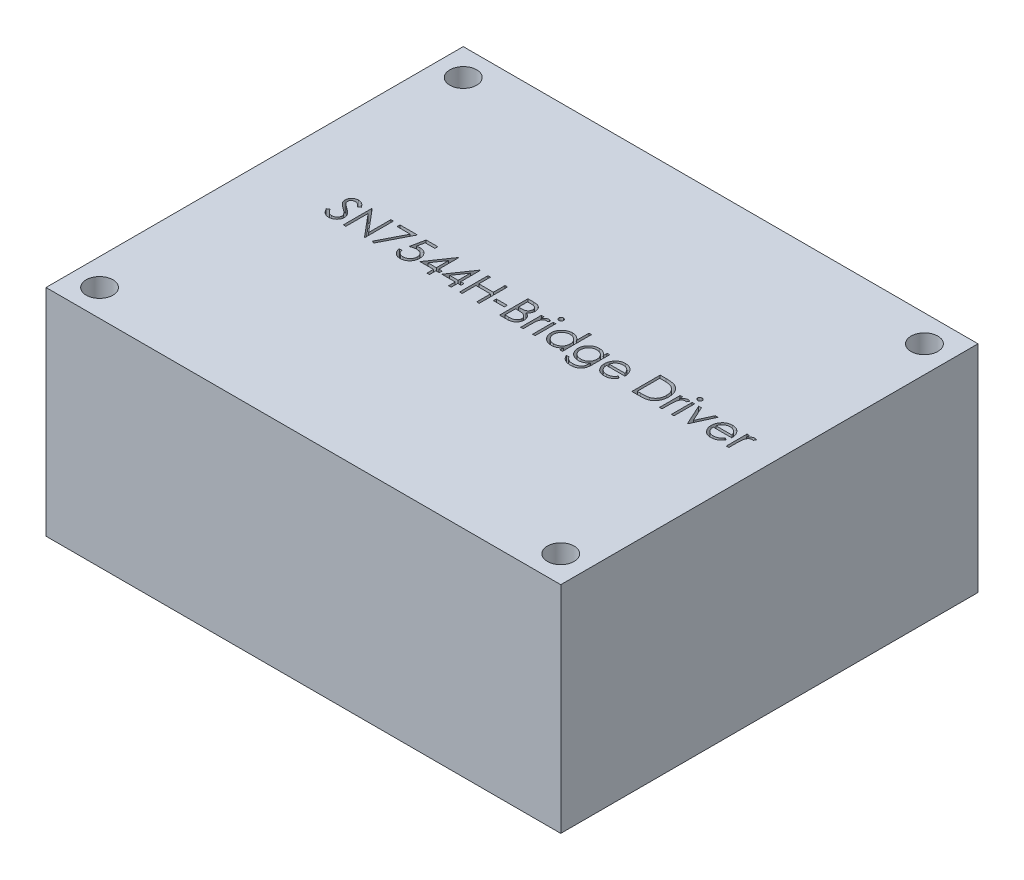
from build123d import *

# Parameters (mm, degrees)
SKETCH1_W           = 57.658
SKETCH1_H           = 46.736
BOSS_EXTRUDE1_DEPTH = 24.13
SKETCH2_R           = 1.5
CUT_EXTRUDE1_DEPTH  = 79.044574187
SKETCH3_W           = 1.221153846
SKETCH3_H           = 0.325641026
SKETCH3_W_2         = 0.284935897
SKETCH3_H_2         = 2.320192307
CUT_EXTRUDE2_DEPTH  = 1.27


with BuildPart() as part:
    # Sketch1 → Boss-Extrude1 (new body)
    with BuildSketch(Plane(origin=(0, 0, 0), x_dir=(1, 0, 0), z_dir=(0, 1, 0))):
        with Locations((28.829, 23.368)):
            Rectangle(SKETCH1_W, SKETCH1_H)
    extrude(amount=BOSS_EXTRUDE1_DEPTH)

    # Sketch2 → Cut-Extrude1 (cut, through all)
    with BuildSketch(Plane(origin=(0, 24.13, 0), x_dir=(1, 0, 0), z_dir=(0, 1, 0))):
        with Locations(Location((3, 43.736, 0), (0, 0, 270))):
            Circle(SKETCH2_R)
        with Locations(Location((3, 3, 0), (0, 0, 270))):
            Circle(SKETCH2_R)
        with Locations(Location((54.658, 3, 0), (0, 0, 270))):
            Circle(SKETCH2_R)
        with Locations(Location((54.658, 43.736, 0), (0, 0, 270))):
            Circle(SKETCH2_R)
    extrude(amount=-CUT_EXTRUDE1_DEPTH, mode=Mode.SUBTRACT)

    # Sketch3 → Cut-Extrude2 (cut)
    # profile 1 of 22: a face of its own
    with BuildSketch(Plane(origin=(0, 24.13, 0), x_dir=(1, 0, 0), z_dir=(0, 1, 0))):
        with BuildLine():
            Line((8.054250064, 23.335222961), (8.322649503, 23.496135421))
            add(Edge.make_bspline(
                [(8.322649503, 23.496135421), (8.347612475, 23.454348444), (8.395440567, 23.374286207), (8.475225014, 23.266102127), (8.557895584, 23.174152171), (8.644064479, 23.098971248), (8.733205732, 23.039781187), (8.825901267, 22.997869162), (8.921838709, 22.971728956), (8.987129247, 22.968553877), (9.019724824, 22.966968755)],
                knots=[0, 0, 0, 0, 1.272034388, 2.437168799, 3.508375237, 4.49857839, 5.41946034, 6.295179144, 7.148887113, 8, 8, 8, 8], degree=3))
            add(Edge.make_bspline(
                [(9.019724824, 22.966968755), (9.04756219, 22.967744065), (9.102749834, 22.969281119), (9.183995583, 22.984050132), (9.262900504, 23.006739706), (9.337838339, 23.039234408), (9.407775075, 23.078548606), (9.469104006, 23.126034067), (9.52212298, 23.179198268), (9.565492677, 23.238509676), (9.598766709, 23.302297375), (9.624340942, 23.367771274), (9.638533259, 23.435959904), (9.640671171, 23.481870824), (9.641750064, 23.505039668)],
                knots=[0, 0, 0, 0, 1.095163259, 2.171163733, 3.241058638, 4.321873601, 5.38011039, 6.391990106, 7.366004449, 8.327778327, 9.272591725, 10.192022065, 11.087607919, 12, 12, 12, 12], degree=3))
            add(Edge.make_bspline(
                [(9.641750064, 23.505039668), (9.640412654, 23.531474582), (9.637693894, 23.585212898), (9.614714622, 23.664496869), (9.578565663, 23.742957986), (9.545216693, 23.791491277), (9.527902909, 23.816688306)],
                knots=[0, 0, 0, 0, 0.938893495, 1.908633276, 2.914225137, 4, 4, 4, 4], degree=3))
            add(Edge.make_bspline(
                [(9.527902909, 23.816688306), (9.513687423, 23.834873639), (9.483843789, 23.87305147), (9.432538045, 23.929879648), (9.372334499, 23.988497786), (9.305293417, 24.051144216), (9.228972686, 24.114905288), (9.145762727, 24.182821512), (9.053539083, 24.252310085), (8.988860254, 24.298912341), (8.955487043, 24.322958338)],
                knots=[0, 0, 0, 0, 0.722233717, 1.516239348, 2.393582979, 3.351407094, 4.387010283, 5.505090956, 6.712668013, 8, 8, 8, 8], degree=3))
            add(Edge.make_bspline(
                [(8.955487043, 24.322958338), (8.922082418, 24.346751414), (8.858215319, 24.392241963), (8.768899319, 24.459755421), (8.689030413, 24.521480931), (8.618963591, 24.577999571), (8.558729671, 24.629319005), (8.507854005, 24.674946421), (8.4676326, 24.716115794), (8.445266466, 24.742823297), (8.435224623, 24.754814308)],
                knots=[0, 0, 0, 0, 1.452282411, 2.77665338, 3.964542531, 5.026858415, 5.96415736, 6.766646006, 7.446254459, 8, 8, 8, 8], degree=3))
            add(Edge.make_bspline(
                [(8.435224623, 24.754814308), (8.421188814, 24.773502391), (8.393585513, 24.810255015), (8.357149208, 24.867699708), (8.32618011, 24.92650367), (8.301902851, 24.986824918), (8.281459281, 25.047816604), (8.267708873, 25.11027452), (8.25909882, 25.173918409), (8.258217089, 25.216747799), (8.257775705, 25.238187705)],
                knots=[0, 0, 0, 0, 1.068054152, 2.10047183, 3.106115577, 4.101338837, 5.06977816, 6.043150881, 7.020423561, 8, 8, 8, 8], degree=3))
            add(Edge.make_bspline(
                [(8.257775705, 25.238187705), (8.258959716, 25.271779001), (8.261302431, 25.338243601), (8.2811149, 25.435335855), (8.312386739, 25.528033533), (8.356197102, 25.615418907), (8.412673415, 25.695216618), (8.478029406, 25.768344567), (8.555872683, 25.829820353), (8.641282562, 25.883534148), (8.734769414, 25.925576523), (8.832732591, 25.957291127), (8.935327792, 25.975260954), (9.004817778, 25.977839747), (9.040077388, 25.979148242)],
                knots=[0, 0, 0, 0, 1.005424448, 1.989358655, 2.955360095, 3.929531133, 4.905563448, 5.876582895, 6.856512386, 7.866279853, 8.892233794, 9.918561126, 10.94386622, 12, 12, 12, 12], degree=3))
            add(Edge.make_bspline(
                [(9.040077388, 25.979148242), (9.077491679, 25.977857784), (9.151896762, 25.975291476), (9.261342836, 25.952978001), (9.3667172, 25.916056678), (9.451483591, 25.874156967), (9.517825453, 25.832309182), (9.568419289, 25.794191199), (9.619688691, 25.750308065), (9.672047212, 25.700542891), (9.724607667, 25.644439053), (9.77815037, 25.582380785), (9.832800528, 25.514747338), (9.86795763, 25.466465112), (9.885980833, 25.441713346)],
                knots=[0, 0, 0, 0, 1.286793592, 2.559021753, 3.825965368, 5.121522368, 5.803751409, 6.523245864, 7.299691795, 8.125521123, 9.008227632, 9.944561021, 10.946284179, 12, 12, 12, 12], degree=3))
            Line((9.885980833, 25.441713346), (9.628393694, 25.246455934))
            add(Edge.make_bspline(
                [(9.628393694, 25.246455934), (9.612839884, 25.266493532), (9.582886882, 25.30508126), (9.537412276, 25.359120954), (9.494551002, 25.408484474), (9.45232314, 25.451360698), (9.412958917, 25.490097633), (9.374752743, 25.523262555), (9.338254439, 25.551180417), (9.292246955, 25.580974218), (9.234445882, 25.610507617), (9.161888482, 25.635498567), (9.086063789, 25.650516373), (9.034420481, 25.652502007), (9.008276506, 25.653507216)],
                knots=[0, 0, 0, 0, 1.181633172, 2.275549214, 3.290209073, 4.226197932, 5.078386478, 5.862611352, 6.581680152, 7.217281963, 8.414376989, 9.595101626, 10.782541182, 12, 12, 12, 12], degree=3))
            add(Edge.make_bspline(
                [(9.008276506, 25.653507216), (8.975477375, 25.652408031), (8.912227341, 25.650288357), (8.822429055, 25.627138084), (8.741608137, 25.590687397), (8.672164025, 25.539601667), (8.614345481, 25.479076195), (8.572521244, 25.409426805), (8.54734788, 25.332517054), (8.544276041, 25.278867123), (8.542711602, 25.251544075)],
                knots=[0, 0, 0, 0, 1.14458467, 2.207223713, 3.21896685, 4.227309161, 5.202851033, 6.127160689, 7.046193047, 8, 8, 8, 8], degree=3))
            add(Edge.make_bspline(
                [(8.542711602, 25.251544075), (8.543068224, 25.234533805), (8.543782052, 25.200485451), (8.553737761, 25.150183089), (8.566527867, 25.100007803), (8.586795825, 25.050185174), (8.614776922, 24.999843863), (8.651520903, 24.948117001), (8.697797265, 24.894548665), (8.733245697, 24.85970769), (8.751961402, 24.841312705)],
                knots=[0, 0, 0, 0, 0.858281714, 1.717966888, 2.583508476, 3.4729293, 4.427298488, 5.488583878, 6.674047936, 8, 8, 8, 8], degree=3))
            add(Edge.make_bspline(
                [(8.751961402, 24.841312705), (8.758911361, 24.835110546), (8.775422874, 24.820375636), (8.805608892, 24.796252638), (8.845471288, 24.766495838), (8.893969142, 24.729677343), (8.951996677, 24.686967731), (9.019560274, 24.638913097), (9.095906808, 24.583953431), (9.150083117, 24.545529091), (9.178729231, 24.525211944)],
                knots=[0, 0, 0, 0, 0.420754252, 0.999615792, 1.744751191, 2.668019286, 3.750313428, 4.999500688, 6.413464383, 8, 8, 8, 8], degree=3))
            add(Edge.make_bspline(
                [(9.178729231, 24.525211944), (9.213187881, 24.500137282), (9.27991228, 24.451583675), (9.374851656, 24.378635165), (9.460933897, 24.307290403), (9.538461231, 24.238005003), (9.60819957, 24.171304518), (9.669375216, 24.10638649), (9.722611512, 24.043716007), (9.779924089, 23.963368027), (9.838487254, 23.864688044), (9.888780621, 23.743785641), (9.920492836, 23.622413265), (9.924639854, 23.540836778), (9.926685961, 23.500587545)],
                knots=[0, 0, 0, 0, 1.163667725, 2.253281268, 3.268753668, 4.215851969, 5.092017293, 5.902905408, 6.650798638, 7.335211899, 8.59617414, 9.77448103, 10.901945474, 12, 12, 12, 12], degree=3))
            add(Edge.make_bspline(
                [(9.926685961, 23.500587545), (9.926089843, 23.472122885), (9.924909183, 23.41574633), (9.911337497, 23.332964939), (9.891453229, 23.252564078), (9.861483739, 23.175537569), (9.824904874, 23.100476249), (9.778489777, 23.029349082), (9.724689235, 22.960581849), (9.662972891, 22.896008253), (9.595439822, 22.836729918), (9.524062471, 22.783998556), (9.448724009, 22.740030862), (9.369833136, 22.704152598), (9.28737173, 22.676091479), (9.201367527, 22.655759805), (9.111678756, 22.64328141), (9.050718319, 22.641986226), (9.019724824, 22.641327729)],
                knots=[0, 0, 0, 0, 0.983748083, 1.948392443, 2.894712957, 3.844097841, 4.80183111, 5.778335162, 6.776009319, 7.81870978, 8.863265674, 9.881300176, 10.883814829, 11.87499822, 12.874611388, 13.892143829, 14.928324115, 16, 16, 16, 16], degree=3))
            add(Edge.make_bspline(
                [(9.019724824, 22.641327729), (8.995744191, 22.641791444), (8.948084937, 22.642713033), (8.877591336, 22.650860338), (8.808521851, 22.662387496), (8.741743181, 22.680688259), (8.676394958, 22.702892374), (8.612761395, 22.730232147), (8.550811653, 22.762995609), (8.49019856, 22.800456095), (8.431076273, 22.844051335), (8.373999327, 22.894827293), (8.317094995, 22.951383572), (8.262042857, 23.015256012), (8.207729362, 23.085412701), (8.155225376, 23.162510032), (8.103444103, 23.24612806), (8.070954358, 23.304969959), (8.054250064, 23.335222961)],
                knots=[0, 0, 0, 0, 0.915332311, 1.819136955, 2.706846663, 3.586547465, 4.459518054, 5.340707479, 6.227863349, 7.133153174, 8.059268498, 9.028702269, 10.047606654, 11.120612155, 12.245963614, 13.433783089, 14.680604001, 16, 16, 16, 16], degree=3))
        make_face()
    # profile 2 of 22: a face of its own
    with BuildSketch(Plane(origin=(0, 24.13, 0), x_dir=(1, 0, 0), z_dir=(0, 1, 0))):
        Polygon((10.577968013, 22.722737986), (10.577968013, 25.897737986), (10.63775367, 25.897737986), (12.735339808, 23.398824724), (12.735339808, 25.897737986), (13.020275705, 25.897737986), (13.020275705, 22.722737986), (12.955401907, 22.722737986), (10.86290391, 25.215927088), (10.86290391, 22.722737986), align=None)
    # profile 3 of 22: a face of its own
    with BuildSketch(Plane(origin=(0, 24.13, 0), x_dir=(1, 0, 0), z_dir=(0, 1, 0))):
        Polygon((13.752968013, 25.897737986), (15.706814167, 25.897737986), (14.03790391, 22.641327729), (13.791765088, 22.776799484), (15.224712804, 25.57209696), (13.752968013, 25.57209696), align=None)
    # profile 4 of 22: a face of its own
    with BuildSketch(Plane(origin=(0, 24.13, 0), x_dir=(1, 0, 0), z_dir=(0, 1, 0))):
        with BuildLine():
            Line((17.986301346, 25.897737986), (17.986301346, 25.57209696))
            Line((17.986301346, 25.57209696), (16.906343413, 25.57209696))
            Line((16.906343413, 25.57209696), (16.735254671, 24.737005814))
            add(Edge.make_bspline(
                [(16.735254671, 24.737005814), (16.768869643, 24.746286132), (16.833993334, 24.76426528), (16.930114065, 24.784227658), (17.021365564, 24.796261311), (17.08057965, 24.797904428), (17.109233037, 24.798699524)],
                knots=[0, 0, 0, 0, 1.100273476, 2.13160584, 3.095893838, 4, 4, 4, 4], degree=3))
            add(Edge.make_bspline(
                [(17.109233037, 24.798699524), (17.144687572, 24.797932139), (17.214400047, 24.79642327), (17.316398234, 24.781934521), (17.413764502, 24.759129027), (17.506295223, 24.727269696), (17.59416158, 24.686530153), (17.676555154, 24.635639492), (17.754712689, 24.576191399), (17.827232042, 24.50784271), (17.89302195, 24.432620957), (17.950866812, 24.351742031), (18.000000019, 24.265991938), (18.039515847, 24.174551386), (18.071070207, 24.078431297), (18.092072374, 23.976620311), (18.106057531, 23.870078088), (18.107619982, 23.797230371), (18.108416731, 23.760082737)],
                knots=[0, 0, 0, 0, 1.052922333, 2.070308379, 3.05430497, 4.020497103, 4.973039431, 5.925935799, 6.892292201, 7.88610001, 8.88166317, 9.857072816, 10.836096531, 11.812156883, 12.81219415, 13.836441305, 14.89672472, 16, 16, 16, 16], degree=3))
            add(Edge.make_bspline(
                [(18.108416731, 23.760082737), (18.107813412, 23.734209009), (18.106614929, 23.682811213), (18.10052021, 23.606480402), (18.088785668, 23.531765546), (18.073030661, 23.458656734), (18.052581468, 23.387292375), (18.027826397, 23.317468203), (17.997531429, 23.24961881), (17.964301539, 23.183102201), (17.926885091, 23.119422127), (17.885357445, 23.059869118), (17.841483035, 23.003549805), (17.794274064, 22.951068205), (17.743291733, 22.902769181), (17.689153477, 22.858366097), (17.632291296, 22.817108033), (17.571825469, 22.780669742), (17.50910336, 22.74713906), (17.443219191, 22.71963128), (17.375672699, 22.695038158), (17.305491705, 22.67543523), (17.232835175, 22.660074984), (17.157583343, 22.649642296), (17.080130878, 22.642043671), (17.027629973, 22.641568004), (17.00111004, 22.641327729)],
                knots=[0, 0, 0, 0, 1.056347294, 2.098418968, 3.122841568, 4.141288669, 5.149314143, 6.15115421, 7.162517403, 8.180376062, 9.185164535, 10.17417709, 11.141909838, 12.097768115, 13.052685741, 14.0056014, 14.954263652, 15.917497458, 16.885230207, 17.854509472, 18.828990115, 19.81800267, 20.826176721, 21.857883937, 22.917946725, 24, 24, 24, 24], degree=3))
            add(Edge.make_bspline(
                [(17.00111004, 22.641327729), (16.969474176, 22.641954418), (16.907234351, 22.643187354), (16.816047837, 22.656085551), (16.728313873, 22.674558533), (16.64473871, 22.702350006), (16.564573349, 22.737172766), (16.488897026, 22.781183865), (16.415776072, 22.831057766), (16.348183011, 22.889913515), (16.285448536, 22.954244169), (16.229290489, 23.024055743), (16.179276459, 23.098196023), (16.13620736, 23.177025063), (16.099469869, 23.26033573), (16.070609129, 23.348440167), (16.047315193, 23.440878027), (16.037460519, 23.504517283), (16.032455192, 23.53684055)],
                knots=[0, 0, 0, 0, 1.0467383, 2.05933395, 3.04377827, 4.011590433, 4.970194871, 5.932262533, 6.905835911, 7.896367577, 8.894135286, 9.877477877, 10.858688626, 11.851381753, 12.8477658, 13.868841284, 14.917554742, 16, 16, 16, 16], degree=3))
            Line((16.032455192, 23.53684055), (16.31739109, 23.53684055))
            add(Edge.make_bspline(
                [(16.31739109, 23.53684055), (16.324401995, 23.506563339), (16.337877345, 23.44836886), (16.367455417, 23.366606857), (16.403619461, 23.293745847), (16.446621977, 23.228822011), (16.497920934, 23.172208135), (16.556458344, 23.121755514), (16.622088065, 23.076239504), (16.695016209, 23.038300279), (16.771953788, 23.005943625), (16.852478328, 22.984397444), (16.934397271, 22.969247349), (16.989804078, 22.967730823), (17.017646498, 22.966968755)],
                knots=[0, 0, 0, 0, 1.136247022, 2.183929868, 3.172523383, 4.106158343, 5.02341133, 5.958108904, 6.928429099, 7.938127109, 8.96079061, 9.975095812, 10.982467395, 12, 12, 12, 12], degree=3))
            add(Edge.make_bspline(
                [(17.017646498, 22.966968755), (17.044823087, 22.967713318), (17.098334013, 22.969179368), (17.177084342, 22.980463329), (17.253114593, 22.997841983), (17.325674552, 23.023849637), (17.396033948, 23.055458774), (17.462413012, 23.096021736), (17.52673205, 23.142703324), (17.586991857, 23.19618541), (17.642181929, 23.255122204), (17.69094641, 23.318148126), (17.731565467, 23.385382694), (17.765795695, 23.455661911), (17.79178833, 23.52975603), (17.81033122, 23.607317811), (17.821219709, 23.688538829), (17.822717565, 23.743937417), (17.823480833, 23.772167072)],
                knots=[0, 0, 0, 0, 1.027316725, 2.022795036, 3.002884548, 3.971462791, 4.93288096, 5.914575861, 6.907176829, 7.935150275, 8.956128384, 9.956726525, 10.942570165, 11.921478529, 12.907843606, 13.90538589, 14.932640048, 16, 16, 16, 16], degree=3))
            add(Edge.make_bspline(
                [(17.823480833, 23.772167072), (17.822883498, 23.79763579), (17.8217143, 23.84748718), (17.812161568, 23.920420746), (17.795545458, 23.989429863), (17.772482367, 24.054847775), (17.743200242, 24.116736184), (17.707416801, 24.17515896), (17.664460505, 24.22934608), (17.615391434, 24.279322897), (17.561635926, 24.325446462), (17.502269102, 24.36476574), (17.438533311, 24.397843722), (17.37119646, 24.426389692), (17.298656874, 24.446891797), (17.222351072, 24.462284093), (17.141455058, 24.471188029), (17.086145934, 24.472423457), (17.057715609, 24.473058498)],
                knots=[0, 0, 0, 0, 1.045622112, 2.046656509, 3.013763289, 3.955457236, 4.890082067, 5.820317437, 6.762574623, 7.722996705, 8.69280354, 9.665887285, 10.63943826, 11.638615906, 12.663482002, 13.728887084, 14.832589034, 16, 16, 16, 16], degree=3))
            add(Edge.make_bspline(
                [(17.057715609, 24.473058498), (17.033105795, 24.472531819), (16.982292773, 24.47144436), (16.904348494, 24.463437467), (16.822441002, 24.450520393), (16.736884281, 24.432752868), (16.647421392, 24.40950182), (16.554241128, 24.38163938), (16.457147572, 24.348327281), (16.391726494, 24.323170202), (16.358096218, 24.310237986)],
                knots=[0, 0, 0, 0, 0.817624296, 1.688186739, 2.600797293, 3.572016777, 4.590301741, 5.671205678, 6.80286297, 8, 8, 8, 8], degree=3))
            Line((16.358096218, 24.310237986), (16.683737243, 25.897737986))
            Line((16.683737243, 25.897737986), (17.986301346, 25.897737986))
        make_face()
    # profile 5 of 22: a face of its own
    with BuildSketch(Plane(origin=(0, 24.13, 0), x_dir=(1, 0, 0), z_dir=(0, 1, 0))):
        Polygon((20.167205793, 25.979148242), (20.225083397, 25.979148242), (20.225083397, 23.781071319), (20.591429551, 23.781071319), (20.591429551, 23.455430293), (20.225083397, 23.455430293), (20.225083397, 22.722737986), (19.9401475, 22.722737986), (19.9401475, 23.455430293), (18.434057756, 23.455430293), align=None)
        Polygon((19.9401475, 23.781071319), (19.9401475, 25.159957537), (18.993753269, 23.781071319), align=None, mode=Mode.SUBTRACT)
    # profile 6 of 22: a face of its own
    with BuildSketch(Plane(origin=(0, 24.13, 0), x_dir=(1, 0, 0), z_dir=(0, 1, 0))):
        Polygon((22.609513485, 25.979148242), (22.66739109, 25.979148242), (22.66739109, 23.781071319), (23.033737243, 23.781071319), (23.033737243, 23.455430293), (22.66739109, 23.455430293), (22.66739109, 22.722737986), (22.382455192, 22.722737986), (22.382455192, 23.455430293), (20.876365449, 23.455430293), align=None)
        Polygon((22.382455192, 23.781071319), (22.382455192, 25.159957537), (21.436060961, 23.781071319), align=None, mode=Mode.SUBTRACT)
    # profile 7 of 22: a face of its own
    with BuildSketch(Plane(origin=(0, 24.13, 0), x_dir=(1, 0, 0), z_dir=(0, 1, 0))):
        Polygon((23.603609038, 25.897737986), (23.888544936, 25.897737986), (23.888544936, 24.595173883), (25.516750064, 24.595173883), (25.516750064, 25.897737986), (25.801685961, 25.897737986), (25.801685961, 22.722737986), (25.516750064, 22.722737986), (25.516750064, 24.269532857), (23.888544936, 24.269532857), (23.888544936, 22.722737986), (23.603609038, 22.722737986), align=None)
    # profile 8 of 22: a face of its own
    with BuildSketch(Plane(origin=(0, 24.13, 0), x_dir=(1, 0, 0), z_dir=(0, 1, 0))):
        with Locations((26.941429551, 23.943891832)):
            Rectangle(SKETCH3_W, SKETCH3_H)
    # profile 9 of 22: a face of its own
    with BuildSketch(Plane(origin=(0, 24.13, 0), x_dir=(1, 0, 0), z_dir=(0, 1, 0))):
        with BuildLine():
            Line((28.081173141, 25.897737986), (28.700654311, 25.897737986))
            add(Edge.make_bspline(
                [(28.700654311, 25.897737986), (28.730978716, 25.897578555), (28.78975496, 25.897269538), (28.875225454, 25.892476984), (28.955279732, 25.885942226), (29.029941011, 25.875573499), (29.099174791, 25.863062387), (29.16318972, 25.847911454), (29.221782233, 25.829744454), (29.291734501, 25.800855328), (29.3714911, 25.757926454), (29.457849642, 25.694491255), (29.531694917, 25.616901092), (29.595363933, 25.529377541), (29.64598352, 25.433097233), (29.68260424, 25.330354969), (29.705788884, 25.22247596), (29.708173249, 25.148413935), (29.709378269, 25.110984179)],
                knots=[0, 0, 0, 0, 1.001505555, 1.941167018, 2.826882275, 3.653841531, 4.429895133, 5.150066043, 5.825578002, 6.45369114, 7.647487171, 8.808567382, 9.977351308, 11.170798116, 12.373658725, 13.556498008, 14.765093433, 16, 16, 16, 16], degree=3))
            add(Edge.make_bspline(
                [(29.709378269, 25.110984179), (29.708386564, 25.07592079), (29.706437769, 25.007017922), (29.687802552, 24.906239694), (29.658628231, 24.810308232), (29.618074184, 24.719573639), (29.565367373, 24.636086004), (29.502903041, 24.559171842), (29.427540513, 24.492087668), (29.371077003, 24.45458375), (29.342396098, 24.435533458)],
                knots=[0, 0, 0, 0, 1.044552857, 2.05264487, 3.044412934, 4.028983338, 5.005914585, 5.980388656, 6.974128949, 8, 8, 8, 8], degree=3))
            add(Edge.make_bspline(
                [(29.342396098, 24.435533458), (29.378464486, 24.421685924), (29.447472246, 24.395192159), (29.542437415, 24.348351417), (29.624257024, 24.29740436), (29.693560149, 24.24176761), (29.752830736, 24.181797474), (29.804585905, 24.116614621), (29.848746866, 24.045368748), (29.886586446, 23.968802683), (29.916112818, 23.887698244), (29.938225245, 23.802816183), (29.950895717, 23.714460872), (29.952698792, 23.654330564), (29.953609038, 23.623974965)],
                knots=[0, 0, 0, 0, 1.27268992, 2.434971085, 3.483601985, 4.442670788, 5.356604649, 6.2567628, 7.179492994, 8.113709626, 9.066344395, 10.018646069, 10.999752585, 12, 12, 12, 12], degree=3))
            add(Edge.make_bspline(
                [(29.953609038, 23.623974965), (29.952722899, 23.592980731), (29.950979396, 23.531998707), (29.938116136, 23.442413692), (29.916336446, 23.356802133), (29.886336192, 23.274610289), (29.847181807, 23.195997167), (29.799531439, 23.120873706), (29.742715664, 23.049994706), (29.679158632, 22.982572562), (29.607256543, 22.921950212), (29.529681537, 22.867960964), (29.445456661, 22.823559894), (29.355965209, 22.786261788), (29.260203294, 22.757770973), (29.158600929, 22.737838709), (29.051245741, 22.724408426), (28.977576895, 22.723304247), (28.939796939, 22.722737986)],
                knots=[0, 0, 0, 0, 0.978564426, 1.925352924, 2.850884081, 3.763762016, 4.682927383, 5.618979971, 6.567305752, 7.547517671, 8.540179244, 9.531824382, 10.526200242, 11.540722885, 12.589160233, 13.674978461, 14.80764778, 16, 16, 16, 16], degree=3))
            Line((28.939796939, 22.722737986), (28.081173141, 22.722737986))
            Line((28.081173141, 22.722737986), (28.081173141, 25.897737986))
        make_face()
        with BuildLine():
            Line((28.366109038, 25.57209696), (28.366109038, 24.554468755))
            Line((28.366109038, 24.554468755), (28.557550344, 24.554468755))
            add(Edge.make_bspline(
                [(28.557550344, 24.554468755), (28.585534609, 24.554831542), (28.63960591, 24.555532521), (28.717910388, 24.557540497), (28.790595226, 24.563163008), (28.85753496, 24.568783903), (28.918624177, 24.577922993), (28.973727537, 24.588801562), (29.023709836, 24.600306769), (29.081349281, 24.619873375), (29.146729741, 24.64879098), (29.216428343, 24.693669003), (29.277873183, 24.747121809), (29.329759203, 24.808799324), (29.372223895, 24.87671365), (29.401718479, 24.949781177), (29.421718515, 25.026180868), (29.423525119, 25.078630283), (29.424442372, 25.105260021)],
                knots=[0, 0, 0, 0, 1.156816544, 2.235205308, 3.236616184, 4.169592532, 5.011045266, 5.787822928, 6.49130361, 7.128639758, 8.301311294, 9.436451833, 10.541879658, 11.654887649, 12.756523258, 13.837046038, 14.901820046, 16, 16, 16, 16], degree=3))
            add(Edge.make_bspline(
                [(29.424442372, 25.105260021), (29.423965051, 25.122881971), (29.423028735, 25.15744935), (29.415360382, 25.207840549), (29.402326939, 25.255233096), (29.385586259, 25.300276468), (29.362192234, 25.341562218), (29.334648235, 25.380517831), (29.301369073, 25.415816681), (29.263489225, 25.448809012), (29.219938546, 25.478059405), (29.170743017, 25.503677812), (29.115237053, 25.524306945), (29.054356106, 25.54237374), (28.987163048, 25.555063121), (28.914433274, 25.565634408), (28.835571065, 25.571016253), (28.781010865, 25.571728689), (28.752807756, 25.57209696)],
                knots=[0, 0, 0, 0, 0.91205012, 1.789085906, 2.630437955, 3.453916878, 4.269457761, 5.079663411, 5.91843418, 6.774407191, 7.675494373, 8.627863946, 9.638891023, 10.736472738, 11.911756761, 13.175263542, 14.539845004, 16, 16, 16, 16], degree=3))
            Line((28.752807756, 25.57209696), (28.366109038, 25.57209696))
        make_face(mode=Mode.SUBTRACT)
        with BuildLine():
            Line((28.366109038, 24.228827729), (28.366109038, 23.048379011))
            Line((28.366109038, 23.048379011), (28.771888285, 23.048379011))
            add(Edge.make_bspline(
                [(28.771888285, 23.048379011), (28.800934025, 23.048727125), (28.85691586, 23.049398068), (28.937743404, 23.051588414), (29.012658077, 23.056570693), (29.081318029, 23.064413714), (29.144464653, 23.072921307), (29.201340427, 23.08436154), (29.252406395, 23.097468811), (29.311619517, 23.117729096), (29.3782977, 23.149203752), (29.450153262, 23.196660229), (29.514039903, 23.253196372), (29.568291817, 23.318629416), (29.612753599, 23.389777834), (29.645098191, 23.465202544), (29.665047039, 23.543657273), (29.667462007, 23.597148505), (29.668673141, 23.623974965)],
                knots=[0, 0, 0, 0, 1.160039823, 2.235823828, 3.228722157, 4.157150951, 4.99529583, 5.772374946, 6.472645482, 7.099169577, 8.269452708, 9.405989375, 10.527446681, 11.663510218, 12.788923519, 13.866172445, 14.929861265, 16, 16, 16, 16], degree=3))
            add(Edge.make_bspline(
                [(29.668673141, 23.623974965), (29.668422675, 23.640751066), (29.667925783, 23.67403267), (29.660432225, 23.72294202), (29.649533929, 23.770318348), (29.635444699, 23.816290298), (29.614925611, 23.860026718), (29.590971103, 23.902392612), (29.562884688, 23.943443982), (29.519120338, 23.995343669), (29.455464323, 24.055139817), (29.365016034, 24.113684551), (29.262171164, 24.160899347), (29.187579081, 24.18094673), (29.149046739, 24.191302689)],
                knots=[0, 0, 0, 0, 0.723448775, 1.435228256, 2.130040452, 2.821711965, 3.505591119, 4.210454504, 4.921174351, 5.648778258, 7.137944449, 8.670945889, 10.280296675, 12, 12, 12, 12], degree=3))
            add(Edge.make_bspline(
                [(29.149046739, 24.191302689), (29.133598916, 24.194436944), (29.10010485, 24.201232655), (29.045487974, 24.208406071), (28.983134721, 24.214796947), (28.912901111, 24.219524211), (28.834698284, 24.224410576), (28.748359222, 24.226310878), (28.654236515, 24.228578064), (28.588929148, 24.228742378), (28.555006274, 24.228827729)],
                knots=[0, 0, 0, 0, 0.634451884, 1.375622551, 2.216452059, 3.157844607, 4.20941857, 5.370758133, 6.634282058, 8, 8, 8, 8], degree=3))
            Line((28.555006274, 24.228827729), (28.366109038, 24.228827729))
        make_face(mode=Mode.SUBTRACT)
    # profile 10 of 22: a face of its own
    with BuildSketch(Plane(origin=(0, 24.13, 0), x_dir=(1, 0, 0), z_dir=(0, 1, 0))):
        with BuildLine():
            Line((30.442070577, 25.042930293), (30.727006474, 25.042930293))
            Line((30.727006474, 25.042930293), (30.727006474, 24.701388827))
            add(Edge.make_bspline(
                [(30.727006474, 24.701388827), (30.748041991, 24.733189471), (30.788272254, 24.794007956), (30.855140411, 24.874443679), (30.923632719, 24.941041614), (30.994077067, 24.994112664), (31.066991486, 25.033857421), (31.140775721, 25.062970389), (31.216590612, 25.080185525), (31.2675375, 25.082483915), (31.293062163, 25.083635421)],
                knots=[0, 0, 0, 0, 1.2804753, 2.448899062, 3.506932113, 4.484331642, 5.4025378, 6.288909075, 7.142734305, 8, 8, 8, 8], degree=3))
            add(Edge.make_bspline(
                [(31.293062163, 25.083635421), (31.31286176, 25.082555444), (31.353600715, 25.080333319), (31.415270636, 25.064720643), (31.478810053, 25.039794151), (31.519760647, 25.016353377), (31.541109038, 25.004133218)],
                knots=[0, 0, 0, 0, 0.901110191, 1.854092781, 2.881294221, 4, 4, 4, 4], degree=3))
            Line((31.541109038, 25.004133218), (31.384648702, 24.757358378))
            add(Edge.make_bspline(
                [(31.384648702, 24.757358378), (31.370942661, 24.763472762), (31.344925972, 24.775079034), (31.306867187, 24.788815001), (31.271777689, 24.79690301), (31.249422461, 24.798128304), (31.239000665, 24.798699524)],
                knots=[0, 0, 0, 0, 1.180555205, 2.24091978, 3.179933427, 4, 4, 4, 4], degree=3))
            add(Edge.make_bspline(
                [(31.239000665, 24.798699524), (31.216135464, 24.79717549), (31.169497082, 24.794066903), (31.101021857, 24.769629556), (31.034576178, 24.730145945), (30.98180617, 24.686357151), (30.940946412, 24.644131649), (30.911790636, 24.607257741), (30.885045572, 24.565911411), (30.859491158, 24.520799483), (30.836208163, 24.471151694), (30.814477856, 24.417464065), (30.794830173, 24.359674412), (30.783626737, 24.319413126), (30.777887884, 24.298789668)],
                knots=[0, 0, 0, 0, 1.125678352, 2.296057538, 3.5422874, 4.923748041, 5.663163013, 6.437101912, 7.23742474, 8.08941207, 8.991984279, 9.93940061, 10.944477711, 12, 12, 12, 12], degree=3))
            add(Edge.make_bspline(
                [(30.777887884, 24.298789668), (30.773594928, 24.280395375), (30.764086354, 24.239653413), (30.754841174, 24.171301537), (30.745706682, 24.090544361), (30.739269036, 23.997157095), (30.733301812, 23.891372949), (30.729936237, 23.77303077), (30.727121245, 23.642009087), (30.727045892, 23.550410924), (30.727006474, 23.502495598)],
                knots=[0, 0, 0, 0, 0.566838948, 1.255505196, 2.06880316, 3.007127437, 4.065329342, 5.249902469, 6.561414163, 8, 8, 8, 8], degree=3))
            Line((30.727006474, 23.502495598), (30.727006474, 22.722737986))
            Line((30.727006474, 22.722737986), (30.442070577, 22.722737986))
            Line((30.442070577, 22.722737986), (30.442070577, 25.042930293))
        make_face()
    # profile 11 of 22: a face of its own
    with BuildSketch(Plane(origin=(0, 24.13, 0), x_dir=(1, 0, 0), z_dir=(0, 1, 0))):
        with BuildLine():
            add(Edge.make_bspline(
                [(31.926535721, 26.01985337), (31.944217129, 26.019033175), (31.978840721, 26.017427075), (32.0289089, 26.003673449), (32.07449919, 25.980360163), (32.114937562, 25.949082167), (32.149637487, 25.912298029), (32.173931417, 25.869425579), (32.18954552, 25.823108099), (32.191431066, 25.790800126), (32.19239109, 25.774350566)],
                knots=[0, 0, 0, 0, 1.055194115, 2.066272739, 3.074728998, 4.095836921, 5.109056067, 6.073838105, 7.019297344, 8, 8, 8, 8], degree=3))
            add(Edge.make_bspline(
                [(32.19239109, 25.774350566), (32.191409416, 25.758328016), (32.189468764, 25.726653332), (32.173943478, 25.681138825), (32.149430448, 25.638862082), (32.114959812, 25.602149366), (32.074493294, 25.570888661), (32.028910466, 25.547570791), (31.978840309, 25.53381838), (31.94421699, 25.532212113), (31.926535721, 25.531391832)],
                knots=[0, 0, 0, 0, 0.96129708, 1.900370562, 2.859976407, 3.87933698, 4.906634145, 5.921202961, 6.938410037, 8, 8, 8, 8], degree=3))
            add(Edge.make_bspline(
                [(31.926535721, 25.531391832), (31.909056643, 25.532180792), (31.875035901, 25.533716401), (31.825717408, 25.547840631), (31.78051585, 25.57089664), (31.739998611, 25.60194468), (31.706225507, 25.639087551), (31.681643455, 25.681113024), (31.666154025, 25.7266599), (31.664208541, 25.758330223), (31.663224423, 25.774350566)],
                knots=[0, 0, 0, 0, 1.054934014, 2.053291228, 3.073705704, 4.106921865, 5.123545215, 6.088680038, 7.033164197, 8, 8, 8, 8], degree=3))
            add(Edge.make_bspline(
                [(31.663224423, 25.774350566), (31.66418698, 25.790797836), (31.666077503, 25.823101314), (31.681655066, 25.869451808), (31.706020748, 25.912070742), (31.740020974, 25.949286731), (31.780509898, 25.980352232), (31.825718946, 26.003403622), (31.875035495, 26.017529052), (31.909056505, 26.019064495), (31.926535721, 26.01985337)],
                knots=[0, 0, 0, 0, 0.98631895, 1.937192651, 2.907499808, 3.917963147, 4.944918757, 5.95915025, 6.951458133, 8, 8, 8, 8], degree=3))
        make_face()
    # profile 12 of 22: a face of its own
    with BuildSketch(Plane(origin=(0, 24.13, 0), x_dir=(1, 0, 0), z_dir=(0, 1, 0))):
        with Locations((31.927807757, 23.88283414)):
            Rectangle(SKETCH3_W_2, SKETCH3_H_2)
    # profile 13 of 22: a face of its own
    with BuildSketch(Plane(origin=(0, 24.13, 0), x_dir=(1, 0, 0), z_dir=(0, 1, 0))):
        with BuildLine():
            Line((35.12316032, 25.979148242), (35.12316032, 22.722737986))
            Line((35.12316032, 22.722737986), (34.838224423, 22.722737986))
            Line((34.838224423, 22.722737986), (34.838224423, 23.124065109))
            add(Edge.make_bspline(
                [(34.838224423, 23.124065109), (34.80609452, 23.087743477), (34.74339261, 23.016861356), (34.638671025, 22.924258243), (34.527665606, 22.847715051), (34.410915122, 22.785893342), (34.288525001, 22.739454834), (34.160766551, 22.706447389), (34.027587655, 22.685225839), (33.936644448, 22.683106733), (33.890558157, 22.682032857)],
                knots=[0, 0, 0, 0, 1.074387032, 2.096679803, 3.090159297, 4.057316773, 5.018401886, 5.985159533, 6.978961417, 8, 8, 8, 8], degree=3))
            add(Edge.make_bspline(
                [(33.890558157, 22.682032857), (33.84958437, 22.683145352), (33.768782249, 22.685339241), (33.649920157, 22.702359331), (33.535536474, 22.729692109), (33.425523111, 22.767702202), (33.320591951, 22.818121947), (33.219844578, 22.878484365), (33.123802921, 22.950367118), (33.033930882, 23.032543401), (32.951170425, 23.121801711), (32.878543413, 23.217002314), (32.817988834, 23.317733547), (32.767352046, 23.422720051), (32.728348219, 23.532770013), (32.701157851, 23.647502873), (32.684157589, 23.766782972), (32.681964607, 23.848008111), (32.680852628, 23.889194316)],
                knots=[0, 0, 0, 0, 1.033919861, 2.038935746, 3.024066025, 3.998881131, 4.97069526, 5.957263378, 6.95902576, 7.993208707, 9.027059324, 10.027763471, 11.009749337, 11.988697705, 12.965288445, 13.950418724, 14.960734635, 16, 16, 16, 16], degree=3))
            add(Edge.make_bspline(
                [(32.680852628, 23.889194316), (32.681989252, 23.929529247), (32.684236297, 24.00926923), (32.700976003, 24.126543477), (32.729125561, 24.239499328), (32.76862968, 24.347773126), (32.81928631, 24.451495886), (32.880906789, 24.550740966), (32.953495567, 24.645781777), (33.037181679, 24.734383532), (33.127836792, 24.816226518), (33.224818283, 24.887354724), (33.325713689, 24.948783579), (33.432087991, 24.997454947), (33.542366722, 25.036833206), (33.657531633, 25.064077399), (33.777103565, 25.080131397), (33.858284226, 25.08245619), (33.899462404, 25.083635421)],
                knots=[0, 0, 0, 0, 1.020392517, 2.01726096, 2.990465484, 3.961182959, 4.928053699, 5.906110375, 6.912531644, 7.948652711, 8.985773172, 9.998621852, 10.987621588, 11.969261332, 12.953316658, 13.946091881, 14.958173133, 16, 16, 16, 16], degree=3))
            add(Edge.make_bspline(
                [(33.899462404, 25.083635421), (33.946830508, 25.082213841), (34.039808832, 25.079423438), (34.175788205, 25.056104091), (34.304409823, 25.016949194), (34.426414176, 24.963344961), (34.541073913, 24.893675708), (34.649229509, 24.809536894), (34.749000094, 24.708547269), (34.808029533, 24.632699627), (34.838224423, 24.593901848)],
                knots=[0, 0, 0, 0, 1.031072012, 2.023879775, 2.993683497, 3.952812103, 4.918022106, 5.908088563, 6.929940113, 8, 8, 8, 8], degree=3))
            Line((34.838224423, 24.593901848), (34.838224423, 25.979148242))
            Line((34.838224423, 25.979148242), (35.12316032, 25.979148242))
        make_face()
        with BuildLine():
            add(Edge.make_bspline(
                [(33.903278509, 24.798699524), (33.861627646, 24.797217581), (33.779415466, 24.794292462), (33.65872555, 24.771456505), (33.543234096, 24.733461195), (33.433518728, 24.681498327), (33.33131256, 24.616157973), (33.239969016, 24.537126433), (33.158740994, 24.446559999), (33.09042564, 24.34486737), (33.034735689, 24.235848673), (32.995577025, 24.121889361), (32.96975135, 24.005044846), (32.967112906, 23.92579441), (32.965788526, 23.886014228)],
                knots=[0, 0, 0, 0, 1.031046209, 2.035121221, 3.029706178, 4.034933723, 5.034054252, 6.02443088, 7.017295772, 8.038157696, 9.050218397, 10.03989886, 11.016116709, 12, 12, 12, 12], degree=3))
            add(Edge.make_bspline(
                [(32.965788526, 23.886014228), (32.96748025, 23.846471773), (32.970857068, 23.767541857), (32.99512377, 23.650538049), (33.035836226, 23.536551882), (33.091391526, 23.426550838), (33.16095725, 23.324420975), (33.241591956, 23.23212815), (33.334075426, 23.152762595), (33.436516807, 23.086325653), (33.545925466, 23.032656795), (33.660981961, 22.995313679), (33.779523433, 22.971203835), (33.860125193, 22.968387631), (33.900734439, 22.966968755)],
                knots=[0, 0, 0, 0, 0.979072187, 1.954306742, 2.945804271, 3.96968567, 4.997920485, 5.998718438, 6.996577872, 8.005894225, 9.015743152, 10.005417472, 10.995077863, 12, 12, 12, 12], degree=3))
            add(Edge.make_bspline(
                [(33.900734439, 22.966968755), (33.941960909, 22.968474579), (34.02395627, 22.971469515), (34.145004241, 22.994403234), (34.262474671, 23.032293501), (34.374767371, 23.08481628), (34.479375576, 23.149910453), (34.573262936, 23.226116886), (34.652652422, 23.314747631), (34.719955718, 23.412153414), (34.772729132, 23.51893501), (34.811170271, 23.632631026), (34.833897743, 23.753245419), (34.836762254, 23.835671982), (34.838224423, 23.877745998)],
                knots=[0, 0, 0, 0, 1.01762866, 2.023962475, 3.030623092, 4.058876274, 5.077231937, 6.066672613, 7.034107872, 8.005628644, 8.981990164, 9.965428785, 10.961468474, 12, 12, 12, 12], degree=3))
            add(Edge.make_bspline(
                [(34.838224423, 23.877745998), (34.837353878, 23.909802459), (34.835640369, 23.972899718), (34.822549781, 24.065543966), (34.801726383, 24.154202417), (34.772383786, 24.238968285), (34.733838121, 24.319372906), (34.687349076, 24.395993603), (34.632099132, 24.468431873), (34.568977687, 24.535690231), (34.499884967, 24.597037093), (34.426774205, 24.651796083), (34.348779199, 24.696780184), (34.267211601, 24.73401048), (34.181929891, 24.763636994), (34.092240114, 24.783401545), (33.999095605, 24.796972694), (33.935553826, 24.798117853), (33.903278509, 24.798699524)],
                knots=[0, 0, 0, 0, 1.050140795, 2.067009409, 3.05949893, 4.030605086, 5.00011959, 5.97591094, 6.962425594, 7.979863591, 8.993523472, 9.986985069, 10.967611495, 11.937549037, 12.921786183, 13.919465291, 14.943216303, 16, 16, 16, 16], degree=3))
        make_face(mode=Mode.SUBTRACT)
    # profile 14 of 22: a face of its own
    with BuildSketch(Plane(origin=(0, 24.13, 0), x_dir=(1, 0, 0), z_dir=(0, 1, 0))):
        with BuildLine():
            Line((37.809698782, 25.042930293), (38.094634679, 25.042930293))
            Line((38.094634679, 25.042930293), (38.094634679, 23.20165926))
            add(Edge.make_bspline(
                [(38.094634679, 23.20165926), (38.094383362, 23.162436584), (38.093898259, 23.086727374), (38.090404878, 22.977254934), (38.083038264, 22.876139271), (38.074684675, 22.782919222), (38.06266801, 22.698026879), (38.047993734, 22.621208929), (38.031451368, 22.552391655), (38.016918743, 22.510005549), (38.010044335, 22.489955534)],
                knots=[0, 0, 0, 0, 1.307562039, 2.523909702, 3.650326591, 4.686913197, 5.643429486, 6.506965704, 7.293745905, 8, 8, 8, 8], degree=3))
            add(Edge.make_bspline(
                [(38.010044335, 22.489955534), (37.999894097, 22.46389339), (37.979897106, 22.412548345), (37.942445139, 22.339764354), (37.900504383, 22.271232986), (37.852601117, 22.207336156), (37.798951959, 22.148394628), (37.740820891, 22.093127857), (37.677075789, 22.042705077), (37.6077531, 21.997996271), (37.534450847, 21.957730872), (37.457211169, 21.922854343), (37.376469614, 21.892476992), (37.291467705, 21.869723313), (37.203538135, 21.850006817), (37.111646894, 21.837175566), (37.016330857, 21.828442449), (36.951519691, 21.827634881), (36.918638085, 21.827225165)],
                knots=[0, 0, 0, 0, 0.981931301, 1.934503488, 2.87077864, 3.801706999, 4.735015492, 5.667491629, 6.616593066, 7.585388521, 8.561939025, 9.551802639, 10.560317337, 11.588439944, 12.640189604, 13.723962949, 14.845264515, 16, 16, 16, 16], degree=3))
            add(Edge.make_bspline(
                [(36.918638085, 21.827225165), (36.870664076, 21.82800212), (36.776957946, 21.829519722), (36.640337703, 21.847200766), (36.510584778, 21.872196519), (36.389413664, 21.9100293), (36.277590076, 21.95632714), (36.175877703, 22.009481133), (36.085189627, 22.070431435), (36.003434581, 22.139828409), (35.929646139, 22.222345463), (35.860224954, 22.319590129), (35.793403957, 22.433043664), (35.754243835, 22.516312768), (35.733737243, 22.559917473)],
                knots=[0, 0, 0, 0, 1.157897085, 2.2616841, 3.32207898, 4.345638746, 5.321241055, 6.241986252, 7.112515963, 7.955008012, 8.825025602, 9.77857164, 10.836726669, 12, 12, 12, 12], degree=3))
            Line((35.733737243, 22.559917473), (36.018673141, 22.559917473))
            add(Edge.make_bspline(
                [(36.018673141, 22.559917473), (36.041589574, 22.523535714), (36.086388378, 22.452413856), (36.170161643, 22.360326921), (36.261970239, 22.281629226), (36.364912523, 22.218210167), (36.479416825, 22.170394856), (36.605552033, 22.136308694), (36.744344547, 22.115901367), (36.840971785, 22.113441836), (36.891289327, 22.112161062)],
                knots=[0, 0, 0, 0, 0.997731894, 1.950442991, 2.880492273, 3.800895997, 4.748200782, 5.754801363, 6.83083817, 8, 8, 8, 8], degree=3))
            add(Edge.make_bspline(
                [(36.891289327, 22.112161062), (36.94097072, 22.113458412), (37.036751474, 22.115959571), (37.174484034, 22.136317802), (37.300209442, 22.170402274), (37.413203339, 22.218125596), (37.5121325, 22.276591322), (37.597414806, 22.341905675), (37.666488906, 22.415548442), (37.712946382, 22.483386223), (37.741824928, 22.543823827), (37.760214743, 22.595850824), (37.775158987, 22.654681649), (37.787659268, 22.720119067), (37.797974311, 22.79225657), (37.804508354, 22.8712591), (37.809230769, 22.956947109), (37.80953917, 23.016358742), (37.809698782, 23.047106976)],
                knots=[0, 0, 0, 0, 1.570740765, 3.028230971, 4.391408896, 5.680370741, 6.894727393, 8.017376726, 9.065722033, 10.075533815, 10.603371122, 11.180248986, 11.817768598, 12.521299649, 13.286540596, 14.121245857, 15.027658897, 16, 16, 16, 16], degree=3))
            Line((37.809698782, 23.047106976), (37.809698782, 23.167314308))
            add(Edge.make_bspline(
                [(37.809698782, 23.167314308), (37.780778054, 23.132895673), (37.723445305, 23.064663816), (37.624433087, 22.975254332), (37.516286313, 22.898250485), (37.3991891, 22.835096438), (37.276009766, 22.784585431), (37.148082457, 22.749258603), (37.01655395, 22.726434979), (36.927425214, 22.723979056), (36.88238508, 22.722737986)],
                knots=[0, 0, 0, 0, 1.012485704, 2.007162095, 2.997754123, 3.998611389, 4.999708251, 5.992315798, 6.98544096, 8, 8, 8, 8], degree=3))
            add(Edge.make_bspline(
                [(36.88238508, 22.722737986), (36.855863607, 22.723205188), (36.803134516, 22.724134064), (36.724798423, 22.732260955), (36.647618311, 22.744052672), (36.57177418, 22.761362263), (36.497156588, 22.783579757), (36.423888844, 22.811353513), (36.351377717, 22.842754371), (36.280941251, 22.879741128), (36.213280975, 22.920891221), (36.148907228, 22.965467214), (36.088157196, 23.013235804), (36.031609095, 23.064668028), (35.979337101, 23.119689447), (35.930638163, 23.177713528), (35.88631757, 23.2395505), (35.845465852, 23.304072812), (35.810035074, 23.371710221), (35.778934251, 23.440996065), (35.751892863, 23.511782195), (35.730334248, 23.584305602), (35.713868595, 23.658520564), (35.701612889, 23.734305499), (35.694661516, 23.811893779), (35.693577549, 23.864164575), (35.693032115, 23.890466351)],
                knots=[0, 0, 0, 0, 1.028754217, 2.045334182, 3.052854819, 4.056607503, 5.061168794, 6.071104265, 7.095078842, 8.125279047, 9.155117945, 10.165957491, 11.161587969, 12.151493252, 13.128948131, 14.104219989, 15.088194871, 16.07871515, 17.064853787, 18.047899887, 19.02414258, 20.002704429, 20.980574569, 21.971845993, 22.979467364, 24, 24, 24, 24], degree=3))
            add(Edge.make_bspline(
                [(35.693032115, 23.890466351), (35.693503073, 23.916776302), (35.694443165, 23.969294303), (35.702562982, 24.047199174), (35.714145554, 24.124060876), (35.732476887, 24.199087161), (35.75454089, 24.273132472), (35.781867273, 24.345649886), (35.814722862, 24.416661491), (35.851924564, 24.486219873), (35.893729419, 24.553391638), (35.939569598, 24.617187952), (35.989500441, 24.677139365), (36.042833108, 24.733850691), (36.100218799, 24.78677476), (36.161627828, 24.835783121), (36.226454869, 24.881697273), (36.294900839, 24.923526843), (36.365909612, 24.960522167), (36.437677147, 24.994279308), (36.511154118, 25.021070974), (36.584970635, 25.044677642), (36.660426701, 25.061400998), (36.736597122, 25.074302603), (36.813742672, 25.082162743), (36.865407084, 25.083143895), (36.891289327, 25.083635421)],
                knots=[0, 0, 0, 0, 1.008818848, 2.013730394, 3.001654427, 3.987803273, 4.973046549, 5.963777569, 6.957074694, 7.972068341, 8.987420212, 9.989399531, 10.982630087, 11.977756091, 12.973280677, 13.973972381, 14.989194003, 16.018387222, 17.047741039, 18.059210846, 19.057554164, 20.045176975, 21.029480261, 22.018708529, 23.007435371, 24, 24, 24, 24], degree=3))
            add(Edge.make_bspline(
                [(36.891289327, 25.083635421), (36.93397125, 25.082404725), (37.018254934, 25.079974478), (37.142289486, 25.060905296), (37.261979946, 25.030503298), (37.378001718, 24.986946262), (37.491299915, 24.927483013), (37.601501131, 24.849157624), (37.708924203, 24.75126753), (37.775216235, 24.67619886), (37.809698782, 24.637151046)],
                knots=[0, 0, 0, 0, 0.96728863, 1.910097829, 2.838038873, 3.762875196, 4.71315279, 5.730631239, 6.819562287, 8, 8, 8, 8], degree=3))
            Line((37.809698782, 24.637151046), (37.809698782, 25.042930293))
        make_face()
        with BuildLine():
            add(Edge.make_bspline(
                [(36.914185961, 24.798699524), (36.872520251, 24.797283415), (36.790030981, 24.794479818), (36.669119413, 24.770545114), (36.552391052, 24.733038476), (36.442077556, 24.679387675), (36.338747535, 24.613987902), (36.247058234, 24.534757784), (36.166862346, 24.444273734), (36.099023537, 24.343353867), (36.045020083, 24.234476517), (36.006789981, 24.119713208), (35.982070317, 24.000918322), (35.979341947, 23.919844604), (35.977968013, 23.879018034)],
                knots=[0, 0, 0, 0, 1.026226791, 2.031711442, 3.026614839, 4.04107745, 5.047145931, 6.032893242, 7.017642609, 8.019221815, 9.021877557, 10.003543541, 10.994637589, 12, 12, 12, 12], degree=3))
            add(Edge.make_bspline(
                [(35.977968013, 23.879018034), (35.978626378, 23.848235708), (35.97992119, 23.787695875), (35.992370435, 23.698852213), (36.012491739, 23.614233643), (36.041009776, 23.533835046), (36.076345435, 23.457195268), (36.120788515, 23.384842248), (36.173086182, 23.31671155), (36.232829103, 23.253307089), (36.298666249, 23.195557496), (36.370075808, 23.144813702), (36.446960928, 23.103311262), (36.527430677, 23.067442074), (36.613437577, 23.041244634), (36.703742819, 23.021252313), (36.798985287, 23.009814368), (36.863911079, 23.008396687), (36.897013485, 23.007673883)],
                knots=[0, 0, 0, 0, 1.039728707, 2.044842319, 3.024901384, 3.974314358, 4.923051295, 5.871625912, 6.837440708, 7.820715446, 8.810779094, 9.792721783, 10.773906224, 11.758876063, 12.764959493, 13.806266761, 14.881525401, 16, 16, 16, 16], degree=3))
            add(Edge.make_bspline(
                [(36.897013485, 23.007673883), (36.930544895, 23.008370214), (36.99611521, 23.009731882), (37.091883131, 23.021437199), (37.182627117, 23.040325706), (37.268263963, 23.067143593), (37.349117008, 23.10136261), (37.42427798, 23.144666541), (37.495358472, 23.193982847), (37.560088929, 23.251506603), (37.618621565, 23.314902277), (37.669630904, 23.38388586), (37.713096154, 23.457419331), (37.749089469, 23.535494401), (37.776567918, 23.618717821), (37.795000068, 23.706881544), (37.807887615, 23.799563185), (37.809085882, 23.863071002), (37.809698782, 23.895554492)],
                knots=[0, 0, 0, 0, 1.121943988, 2.193949579, 3.223793937, 4.220241907, 5.192961521, 6.155822191, 7.11847367, 8.083710714, 9.04790392, 10.001595906, 10.949595423, 11.902125208, 12.873731292, 13.87582262, 14.913508608, 16, 16, 16, 16], degree=3))
            add(Edge.make_bspline(
                [(37.809698782, 23.895554492), (37.808483602, 23.937843545), (37.806109568, 24.020461495), (37.783705718, 24.140845491), (37.747583099, 24.254028503), (37.696922116, 24.359652566), (37.633438437, 24.456598515), (37.556974596, 24.54307086), (37.468849268, 24.619180922), (37.369315648, 24.682588569), (37.262229752, 24.733810785), (37.150178381, 24.772238964), (37.033327891, 24.794005235), (36.954128505, 24.797125755), (36.914185961, 24.798699524)],
                knots=[0, 0, 0, 0, 1.070913519, 2.092188694, 3.091357305, 4.074328408, 5.051968682, 6.018948707, 6.99050112, 7.9935919, 9.000589572, 9.992915277, 10.987769056, 12, 12, 12, 12], degree=3))
        make_face(mode=Mode.SUBTRACT)
    # profile 15 of 22: a face of its own
    with BuildSketch(Plane(origin=(0, 24.13, 0), x_dir=(1, 0, 0), z_dir=(0, 1, 0))):
        with BuildLine():
            Line((40.650153509, 23.455430293), (40.903288526, 23.322502609))
            add(Edge.make_bspline(
                [(40.903288526, 23.322502609), (40.883116757, 23.286721873), (40.843870484, 23.217106729), (40.776378377, 23.12146497), (40.705628425, 23.035424542), (40.628426968, 22.96128407), (40.54708376, 22.896648885), (40.461147708, 22.840099573), (40.370171424, 22.791913487), (40.274150602, 22.751316551), (40.172278866, 22.720102224), (40.064309348, 22.698054823), (39.950035206, 22.684426573), (39.871706885, 22.682843481), (39.831598822, 22.682032857)],
                knots=[0, 0, 0, 0, 1.120438281, 2.179929193, 3.190490725, 4.156257408, 5.095198341, 6.022838206, 6.959905092, 7.901321166, 8.864066838, 9.862729781, 10.905609505, 12, 12, 12, 12], degree=3))
            add(Edge.make_bspline(
                [(39.831598822, 22.682032857), (39.787020028, 22.683073509), (39.700059716, 22.68510352), (39.573477231, 22.702604541), (39.45429733, 22.731154466), (39.342526713, 22.771037493), (39.238439098, 22.82313228), (39.141827609, 22.886595524), (39.052184182, 22.961101212), (38.972333649, 23.047294701), (38.900448127, 23.139534762), (38.837015419, 23.235651886), (38.783986178, 23.335404239), (38.740849167, 23.438156786), (38.706010468, 23.543261889), (38.681729244, 23.651675864), (38.667732258, 23.763105286), (38.665587368, 23.838486441), (38.664506474, 23.876473963)],
                knots=[0, 0, 0, 0, 1.145258523, 2.234067595, 3.276747158, 4.290159414, 5.277019952, 6.260822364, 7.254936242, 8.264827045, 9.274100331, 10.257902744, 11.220704747, 12.172965371, 13.118907548, 14.062713208, 15.023725156, 16, 16, 16, 16], degree=3))
            add(Edge.make_bspline(
                [(38.664506474, 23.876473963), (38.665467267, 23.912119988), (38.667371431, 23.982765702), (38.679373645, 24.087328017), (38.700644596, 24.188953827), (38.729833119, 24.287727577), (38.767526035, 24.383483884), (38.81363812, 24.476281027), (38.868241205, 24.566020261), (38.910398559, 24.622628818), (38.931633878, 24.651143434)],
                knots=[0, 0, 0, 0, 1.024358464, 2.0301432, 3.019427413, 4.004406732, 4.986367066, 5.972626655, 6.978780325, 8, 8, 8, 8], degree=3))
            add(Edge.make_bspline(
                [(38.931633878, 24.651143434), (38.960397276, 24.685495909), (39.01701292, 24.75311266), (39.112767614, 24.841956713), (39.216454221, 24.916382137), (39.326773339, 24.978074325), (39.44500714, 25.024949705), (39.569566283, 25.059881583), (39.701869065, 25.079455922), (39.792315944, 25.082220742), (39.838595016, 25.083635421)],
                knots=[0, 0, 0, 0, 1.030682036, 2.02871468, 2.997146059, 3.962720338, 4.930598197, 5.918074684, 6.934738563, 8, 8, 8, 8], degree=3))
            add(Edge.make_bspline(
                [(39.838595016, 25.083635421), (39.886172486, 25.082407106), (39.979508638, 25.07999743), (40.115609205, 25.057657828), (40.244387855, 25.022231582), (40.365793055, 24.972199215), (40.479837115, 24.907647335), (40.585778745, 24.827690094), (40.68542976, 24.734782257), (40.743403971, 24.663332774), (40.772904912, 24.626974764)],
                knots=[0, 0, 0, 0, 1.056321875, 2.072262726, 3.055038591, 4.01806755, 4.982017516, 5.957941055, 6.960871419, 8, 8, 8, 8], degree=3))
            add(Edge.make_bspline(
                [(40.772904912, 24.626974764), (40.792977206, 24.599575801), (40.832988187, 24.544960251), (40.883105199, 24.455904987), (40.926609407, 24.362731805), (40.961382879, 24.263934607), (40.989540141, 24.160683988), (41.009911683, 24.052241822), (41.021858409, 23.938640402), (41.024206727, 23.861237027), (41.02540391, 23.821776447)],
                knots=[0, 0, 0, 0, 0.94817472, 1.890038105, 2.849395472, 3.817997239, 4.812318967, 5.836947057, 6.897266129, 8, 8, 8, 8], degree=3))
            Line((41.02540391, 23.821776447), (38.949442372, 23.821776447))
            add(Edge.make_bspline(
                [(38.949442372, 23.821776447), (38.950839015, 23.791205312), (38.953585457, 23.731088407), (38.966389908, 23.643122054), (38.986572724, 23.559326236), (39.014938231, 23.480329477), (39.049288869, 23.405100004), (39.091367341, 23.33419587), (39.141568222, 23.267940034), (39.197562249, 23.205739845), (39.2598894, 23.150349011), (39.325460178, 23.100772043), (39.395213626, 23.059219823), (39.468599745, 23.025492351), (39.545499864, 22.999088765), (39.625938213, 22.981065813), (39.709756504, 22.968994366), (39.766893563, 22.967652098), (39.795981835, 22.966968755)],
                knots=[0, 0, 0, 0, 1.094153842, 2.151609401, 3.174256925, 4.172055639, 5.149267565, 6.128595816, 7.11444997, 8.118368179, 9.117203808, 10.09244225, 11.054858984, 12.015122123, 12.976791628, 13.957293641, 14.960065497, 16, 16, 16, 16], degree=3))
            add(Edge.make_bspline(
                [(39.795981835, 22.966968755), (39.824421804, 22.967520349), (39.88085216, 22.968614818), (39.964890652, 22.979257337), (40.047567223, 22.996466087), (40.128539686, 23.019952007), (40.206164668, 23.048596722), (40.278051703, 23.083161458), (40.34416447, 23.121397299), (40.40595629, 23.165130362), (40.465892119, 23.218659217), (40.525348518, 23.285457335), (40.589099482, 23.364458164), (40.629004327, 23.423917447), (40.650153509, 23.455430293)],
                knots=[0, 0, 0, 0, 0.99110716, 1.966546729, 2.947904876, 3.932708344, 4.903319531, 5.828989031, 6.710028674, 7.56322171, 8.463672341, 9.504779593, 10.677557249, 12, 12, 12, 12], degree=3))
        make_face()
        with BuildLine():
            add(Edge.make_bspline(
                [(40.740468013, 24.106712345), (40.730038932, 24.144506523), (40.709966308, 24.21724815), (40.668023321, 24.317978101), (40.620786994, 24.407502125), (40.564887281, 24.485135078), (40.501551723, 24.554081122), (40.428395021, 24.614332267), (40.346356746, 24.668232383), (40.255860955, 24.713727865), (40.160028764, 24.752453665), (40.059693147, 24.778420735), (39.957315011, 24.796209391), (39.888068908, 24.797865932), (39.853223421, 24.798699524)],
                knots=[0, 0, 0, 0, 1.154881502, 2.222775134, 3.210006277, 4.132804581, 5.035138423, 5.962687519, 6.919655026, 7.923214229, 8.944639381, 9.960483929, 10.97369054, 12, 12, 12, 12], degree=3))
            add(Edge.make_bspline(
                [(39.853223421, 24.798699524), (39.824785002, 24.798144651), (39.768568226, 24.797047782), (39.685745114, 24.786642736), (39.606207102, 24.769443449), (39.529367305, 24.745889524), (39.45623266, 24.714494577), (39.385298835, 24.677679793), (39.318369475, 24.632738499), (39.276512729, 24.598485824), (39.255366851, 24.581181495)],
                knots=[0, 0, 0, 0, 1.04873581, 2.073130211, 3.073294108, 4.04793562, 5.032784715, 6.005352987, 6.992311501, 8, 8, 8, 8], degree=3))
            add(Edge.make_bspline(
                [(39.255366851, 24.581181495), (39.240223659, 24.567488795), (39.20957753, 24.539778106), (39.168628629, 24.492035897), (39.129421486, 24.440554123), (39.093740244, 24.383363188), (39.061012719, 24.321114339), (39.030387597, 24.254332627), (39.00282278, 24.182511287), (38.987314166, 24.132462003), (38.9793352, 24.106712345)],
                knots=[0, 0, 0, 0, 0.879870761, 1.780643979, 2.707998968, 3.669668524, 4.684282772, 5.740141944, 6.837334558, 8, 8, 8, 8], degree=3))
            Line((38.9793352, 24.106712345), (40.740468013, 24.106712345))
        make_face(mode=Mode.SUBTRACT)
    # profile 16 of 22: a face of its own
    with BuildSketch(Plane(origin=(0, 24.13, 0), x_dir=(1, 0, 0), z_dir=(0, 1, 0))):
        with BuildLine():
            Line((42.897839808, 22.722737986), (42.897839808, 25.897737986))
            Line((42.897839808, 25.897737986), (43.538945577, 25.897737986))
            add(Edge.make_bspline(
                [(43.538945577, 25.897737986), (43.59470673, 25.897336511), (43.702436989, 25.896560865), (43.858113995, 25.891642889), (44.002153551, 25.882942966), (44.13408193, 25.870270611), (44.254261315, 25.854710359), (44.362355195, 25.83520642), (44.458922497, 25.812175723), (44.518312632, 25.792540207), (44.5463975, 25.783254812)],
                knots=[0, 0, 0, 0, 1.314313732, 2.53924729, 3.670748893, 4.714932338, 5.66265055, 6.526160246, 7.303039223, 8, 8, 8, 8], degree=3))
            add(Edge.make_bspline(
                [(44.5463975, 25.783254812), (44.583132013, 25.769256958), (44.655768024, 25.741578674), (44.75918877, 25.689366886), (44.856548207, 25.630209287), (44.948368431, 25.564027897), (45.032552038, 25.48894881), (45.112387773, 25.408161311), (45.184609701, 25.318727602), (45.250747941, 25.222502434), (45.310379575, 25.120619358), (45.362212954, 25.01327251), (45.405260505, 24.901007043), (45.440995789, 24.784135158), (45.469159361, 24.662399873), (45.488374399, 24.535659437), (45.501048083, 24.404414744), (45.502321758, 24.31535648), (45.502968013, 24.270168875)],
                knots=[0, 0, 0, 0, 0.984719456, 1.947108742, 2.898477687, 3.838006223, 4.779231079, 5.722358779, 6.681677486, 7.655904652, 8.64651281, 9.637519902, 10.640069247, 11.656948941, 12.698408672, 13.768548281, 14.867775369, 16, 16, 16, 16], degree=3))
            add(Edge.make_bspline(
                [(45.502968013, 24.270168875), (45.502397449, 24.230924751), (45.501273095, 24.153590107), (45.491177215, 24.039615866), (45.476502982, 23.929022841), (45.453784317, 23.82233767), (45.426204894, 23.718625644), (45.390858842, 23.618992108), (45.350368071, 23.522523081), (45.303151395, 23.430522942), (45.251315996, 23.343361597), (45.195688415, 23.261196654), (45.136327984, 23.18520056), (45.07266866, 23.115143176), (45.005533088, 23.051130115), (44.934481731, 22.992626644), (44.85933125, 22.940777484), (44.780418237, 22.893545179), (44.695440605, 22.852342428), (44.602788784, 22.817480919), (44.502067644, 22.788591489), (44.393524412, 22.764487891), (44.276971542, 22.745367766), (44.152294766, 22.73255311), (44.019685639, 22.723887235), (43.928627306, 22.723128507), (43.881759078, 22.722737986)],
                knots=[0, 0, 0, 0, 1.105936401, 2.179363191, 3.223086493, 4.248585256, 5.251745608, 6.245858792, 7.225916811, 8.198733463, 9.158002045, 10.082870192, 10.993790845, 11.873723703, 12.748670949, 13.606408763, 14.465103618, 15.319838547, 16.196477973, 17.123216899, 18.106603292, 19.147568657, 20.255746949, 21.433717677, 22.679120308, 24, 24, 24, 24], degree=3))
            Line((43.881759078, 22.722737986), (42.897839808, 22.722737986))
        make_face()
        with BuildLine():
            Line((43.182775705, 23.048379011), (43.547213806, 23.048379011))
            add(Edge.make_bspline(
                [(43.547213806, 23.048379011), (43.599581685, 23.04860407), (43.700304295, 23.049036941), (43.845136907, 23.052835332), (43.977470359, 23.059041947), (44.097323443, 23.06772791), (44.204628486, 23.079220154), (44.299609745, 23.092033459), (44.381955872, 23.10799686), (44.431784719, 23.122466659), (44.454810961, 23.12915325)],
                knots=[0, 0, 0, 0, 1.375205317, 2.645023457, 3.804390687, 4.853969522, 5.800190428, 6.637939096, 7.370582563, 8, 8, 8, 8], degree=3))
            add(Edge.make_bspline(
                [(44.454810961, 23.12915325), (44.48379269, 23.139360021), (44.541063919, 23.159529774), (44.623506046, 23.196321366), (44.700392757, 23.239902387), (44.773063995, 23.288345878), (44.840488889, 23.343360466), (44.90346648, 23.403749863), (44.961869972, 23.469821408), (45.015095951, 23.541493098), (45.062728484, 23.618318841), (45.103977385, 23.699543354), (45.140128417, 23.784276675), (45.168502569, 23.873819983), (45.190741706, 23.967372772), (45.206493959, 24.064941623), (45.216304459, 24.166508314), (45.217448772, 24.23558917), (45.218032115, 24.270804893)],
                knots=[0, 0, 0, 0, 0.998632004, 1.973411704, 2.929992603, 3.868527914, 4.809262121, 5.754881198, 6.702106254, 7.672490631, 8.653608572, 9.636854334, 10.631411391, 11.644891563, 12.686317036, 13.754757253, 14.855430412, 16, 16, 16, 16], degree=3))
            add(Edge.make_bspline(
                [(45.218032115, 24.270804893), (45.21756649, 24.307937407), (45.216651766, 24.38088456), (45.205154356, 24.487918976), (45.188352659, 24.590862138), (45.16405603, 24.689720929), (45.133094447, 24.78468822), (45.094455022, 24.875238776), (45.050307445, 24.962328907), (44.997780847, 25.04394851), (44.940253845, 25.121140116), (44.876411054, 25.191856361), (44.807266776, 25.256258334), (44.733575163, 25.315348996), (44.653259366, 25.366751045), (44.568211375, 25.412731105), (44.477183516, 25.451752664), (44.413853427, 25.472507061), (44.381668934, 25.483054492)],
                knots=[0, 0, 0, 0, 1.122418816, 2.205001699, 3.251619955, 4.274784885, 5.280384055, 6.268708349, 7.249350384, 8.229342522, 9.199999885, 10.157847722, 11.105861043, 12.055065948, 13.010012805, 13.98527497, 14.976112212, 16, 16, 16, 16], degree=3))
            add(Edge.make_bspline(
                [(44.381668934, 25.483054492), (44.355043251, 25.490417252), (44.298429744, 25.506072498), (44.206046802, 25.523149801), (44.102074488, 25.538212453), (43.986051188, 25.550965103), (43.858109157, 25.560115745), (43.718149997, 25.566984009), (43.566113213, 25.571616454), (43.460719057, 25.571932781), (43.406017893, 25.57209696)],
                knots=[0, 0, 0, 0, 0.674548936, 1.434276114, 2.292660221, 3.240891867, 4.284742987, 5.42552168, 6.663806718, 8, 8, 8, 8], degree=3))
            Line((43.406017893, 25.57209696), (43.182775705, 25.57209696))
            Line((43.182775705, 25.57209696), (43.182775705, 23.048379011))
        make_face(mode=Mode.SUBTRACT)
    # profile 17 of 22: a face of its own
    with BuildSketch(Plane(origin=(0, 24.13, 0), x_dir=(1, 0, 0), z_dir=(0, 1, 0))):
        with BuildLine():
            Line((45.991429551, 25.042930293), (46.276365449, 25.042930293))
            Line((46.276365449, 25.042930293), (46.276365449, 24.701388827))
            add(Edge.make_bspline(
                [(46.276365449, 24.701388827), (46.297400965, 24.733189471), (46.337631228, 24.794007956), (46.404499385, 24.874443679), (46.472991693, 24.941041614), (46.543436042, 24.994112664), (46.616350461, 25.033857421), (46.690134695, 25.062970389), (46.765949586, 25.080185525), (46.816896474, 25.082483915), (46.842421138, 25.083635421)],
                knots=[0, 0, 0, 0, 1.2804753, 2.448899062, 3.506932113, 4.484331642, 5.4025378, 6.288909075, 7.142734305, 8, 8, 8, 8], degree=3))
            add(Edge.make_bspline(
                [(46.842421138, 25.083635421), (46.862220734, 25.082555444), (46.90295969, 25.080333319), (46.96462961, 25.064720643), (47.028169028, 25.039794151), (47.069119622, 25.016353377), (47.090468013, 25.004133218)],
                knots=[0, 0, 0, 0, 0.901110191, 1.854092781, 2.881294221, 4, 4, 4, 4], degree=3))
            Line((47.090468013, 25.004133218), (46.934007676, 24.757358378))
            add(Edge.make_bspline(
                [(46.934007676, 24.757358378), (46.920301636, 24.763472762), (46.894284947, 24.775079034), (46.856226162, 24.788815001), (46.821136663, 24.79690301), (46.798781435, 24.798128304), (46.788359639, 24.798699524)],
                knots=[0, 0, 0, 0, 1.180555205, 2.24091978, 3.179933427, 4, 4, 4, 4], degree=3))
            add(Edge.make_bspline(
                [(46.788359639, 24.798699524), (46.765494438, 24.79717549), (46.718856056, 24.794066903), (46.650380831, 24.769629556), (46.583935152, 24.730145945), (46.531165144, 24.686357151), (46.490305386, 24.644131649), (46.46114961, 24.607257741), (46.434404547, 24.565911411), (46.408850133, 24.520799483), (46.385567137, 24.471151694), (46.36383683, 24.417464065), (46.344189147, 24.359674412), (46.332985711, 24.319413126), (46.327246859, 24.298789668)],
                knots=[0, 0, 0, 0, 1.125678352, 2.296057538, 3.5422874, 4.923748041, 5.663163013, 6.437101912, 7.23742474, 8.08941207, 8.991984279, 9.93940061, 10.944477711, 12, 12, 12, 12], degree=3))
            add(Edge.make_bspline(
                [(46.327246859, 24.298789668), (46.322953902, 24.280395375), (46.313445329, 24.239653413), (46.304200148, 24.171301537), (46.295065657, 24.090544361), (46.28862801, 23.997157095), (46.282660786, 23.891372949), (46.279295212, 23.77303077), (46.27648022, 23.642009087), (46.276404866, 23.550410924), (46.276365449, 23.502495598)],
                knots=[0, 0, 0, 0, 0.566838948, 1.255505196, 2.06880316, 3.007127437, 4.065329342, 5.249902469, 6.561414163, 8, 8, 8, 8], degree=3))
            Line((46.276365449, 23.502495598), (46.276365449, 22.722737986))
            Line((46.276365449, 22.722737986), (45.991429551, 22.722737986))
            Line((45.991429551, 22.722737986), (45.991429551, 25.042930293))
        make_face()
    # profile 18 of 22: a face of its own
    with BuildSketch(Plane(origin=(0, 24.13, 0), x_dir=(1, 0, 0), z_dir=(0, 1, 0))):
        with BuildLine():
            add(Edge.make_bspline(
                [(47.475894695, 26.01985337), (47.493576103, 26.019033175), (47.528199696, 26.017427075), (47.578267874, 26.003673449), (47.623858164, 25.980360163), (47.664296536, 25.949082167), (47.698996462, 25.912298029), (47.723290392, 25.869425579), (47.738904494, 25.823108099), (47.740790041, 25.790800126), (47.741750064, 25.774350566)],
                knots=[0, 0, 0, 0, 1.055194115, 2.066272739, 3.074728998, 4.095836921, 5.109056067, 6.073838105, 7.019297344, 8, 8, 8, 8], degree=3))
            add(Edge.make_bspline(
                [(47.741750064, 25.774350566), (47.74076839, 25.758328016), (47.738827738, 25.726653332), (47.723302452, 25.681138825), (47.698789422, 25.638862082), (47.664318787, 25.602149366), (47.623852268, 25.570888661), (47.578269441, 25.547570791), (47.528199284, 25.53381838), (47.493575964, 25.532212113), (47.475894695, 25.531391832)],
                knots=[0, 0, 0, 0, 0.96129708, 1.900370562, 2.859976407, 3.87933698, 4.906634145, 5.921202961, 6.938410037, 8, 8, 8, 8], degree=3))
            add(Edge.make_bspline(
                [(47.475894695, 25.531391832), (47.458415617, 25.532180792), (47.424394875, 25.533716401), (47.375076383, 25.547840631), (47.329874824, 25.57089664), (47.289357586, 25.60194468), (47.255584482, 25.639087551), (47.231002429, 25.681113024), (47.215513, 25.7266599), (47.213567515, 25.758330223), (47.212583397, 25.774350566)],
                knots=[0, 0, 0, 0, 1.054934014, 2.053291228, 3.073705704, 4.106921865, 5.123545215, 6.088680038, 7.033164197, 8, 8, 8, 8], degree=3))
            add(Edge.make_bspline(
                [(47.212583397, 25.774350566), (47.213545954, 25.790797836), (47.215436477, 25.823101314), (47.23101404, 25.869451808), (47.255379723, 25.912070742), (47.289379948, 25.949286731), (47.329868873, 25.980352232), (47.37507792, 26.003403622), (47.424394469, 26.017529052), (47.458415479, 26.019064495), (47.475894695, 26.01985337)],
                knots=[0, 0, 0, 0, 0.98631895, 1.937192651, 2.907499808, 3.917963147, 4.944918757, 5.95915025, 6.951458133, 8, 8, 8, 8], degree=3))
        make_face()
    # profile 19 of 22: a face of its own
    with BuildSketch(Plane(origin=(0, 24.13, 0), x_dir=(1, 0, 0), z_dir=(0, 1, 0))):
        with Locations((47.477166731, 23.88283414)):
            Rectangle(SKETCH3_W_2, SKETCH3_H_2)
    # profile 20 of 22: a face of its own
    with BuildSketch(Plane(origin=(0, 24.13, 0), x_dir=(1, 0, 0), z_dir=(0, 1, 0))):
        Polygon((48.06739109, 25.042930293), (48.375859639, 25.042930293), (49.146076987, 23.353667473), (49.916294335, 25.042930293), (50.224762884, 25.042930293), (49.166429551, 22.722737986), (49.125724423, 22.722737986), align=None)
    # profile 21 of 22: a face of its own
    with BuildSketch(Plane(origin=(0, 24.13, 0), x_dir=(1, 0, 0), z_dir=(0, 1, 0))):
        with BuildLine():
            Line((52.617461202, 23.455430293), (52.870596218, 23.322502609))
            add(Edge.make_bspline(
                [(52.870596218, 23.322502609), (52.850424449, 23.286721873), (52.811178176, 23.217106729), (52.743686069, 23.12146497), (52.672936117, 23.035424542), (52.595734661, 22.96128407), (52.514391452, 22.896648885), (52.428455401, 22.840099573), (52.337479116, 22.791913487), (52.241458294, 22.751316551), (52.139586559, 22.720102224), (52.03161704, 22.698054823), (51.917342898, 22.684426573), (51.839014578, 22.682843481), (51.798906514, 22.682032857)],
                knots=[0, 0, 0, 0, 1.120438281, 2.179929193, 3.190490725, 4.156257408, 5.095198341, 6.022838206, 6.959905092, 7.901321166, 8.864066838, 9.862729781, 10.905609505, 12, 12, 12, 12], degree=3))
            add(Edge.make_bspline(
                [(51.798906514, 22.682032857), (51.75432772, 22.683073509), (51.667367408, 22.68510352), (51.540784923, 22.702604541), (51.421605022, 22.731154466), (51.309834406, 22.771037493), (51.205746791, 22.82313228), (51.109135301, 22.886595524), (51.019491874, 22.961101212), (50.939641341, 23.047294701), (50.867755819, 23.139534762), (50.804323111, 23.235651886), (50.75129387, 23.335404239), (50.708156859, 23.438156786), (50.67331816, 23.543261889), (50.649036936, 23.651675864), (50.635039951, 23.763105286), (50.632895061, 23.838486441), (50.631814167, 23.876473963)],
                knots=[0, 0, 0, 0, 1.145258523, 2.234067595, 3.276747158, 4.290159414, 5.277019952, 6.260822364, 7.254936242, 8.264827045, 9.274100331, 10.257902744, 11.220704747, 12.172965371, 13.118907548, 14.062713208, 15.023725156, 16, 16, 16, 16], degree=3))
            add(Edge.make_bspline(
                [(50.631814167, 23.876473963), (50.632774959, 23.912119988), (50.634679123, 23.982765702), (50.646681337, 24.087328017), (50.667952289, 24.188953827), (50.697140811, 24.287727577), (50.734833727, 24.383483884), (50.780945812, 24.476281027), (50.835548897, 24.566020261), (50.877706252, 24.622628818), (50.89894157, 24.651143434)],
                knots=[0, 0, 0, 0, 1.024358464, 2.0301432, 3.019427413, 4.004406732, 4.986367066, 5.972626655, 6.978780325, 8, 8, 8, 8], degree=3))
            add(Edge.make_bspline(
                [(50.89894157, 24.651143434), (50.927704968, 24.685495909), (50.984320613, 24.75311266), (51.080075307, 24.841956713), (51.183761913, 24.916382137), (51.294081031, 24.978074325), (51.412314833, 25.024949705), (51.536873975, 25.059881583), (51.669176757, 25.079455922), (51.759623636, 25.082220742), (51.805902708, 25.083635421)],
                knots=[0, 0, 0, 0, 1.030682036, 2.02871468, 2.997146059, 3.962720338, 4.930598197, 5.918074684, 6.934738563, 8, 8, 8, 8], degree=3))
            add(Edge.make_bspline(
                [(51.805902708, 25.083635421), (51.853480179, 25.082407106), (51.94681633, 25.07999743), (52.082916897, 25.057657828), (52.211695547, 25.022231582), (52.333100748, 24.972199215), (52.447144807, 24.907647335), (52.553086438, 24.827690094), (52.652737453, 24.734782257), (52.710711664, 24.663332774), (52.740212604, 24.626974764)],
                knots=[0, 0, 0, 0, 1.056321875, 2.072262726, 3.055038591, 4.01806755, 4.982017516, 5.957941055, 6.960871419, 8, 8, 8, 8], degree=3))
            add(Edge.make_bspline(
                [(52.740212604, 24.626974764), (52.760284898, 24.599575801), (52.800295879, 24.544960251), (52.850412891, 24.455904987), (52.893917099, 24.362731805), (52.928690571, 24.263934607), (52.956847833, 24.160683988), (52.977219376, 24.052241822), (52.989166101, 23.938640402), (52.991514419, 23.861237027), (52.992711602, 23.821776447)],
                knots=[0, 0, 0, 0, 0.94817472, 1.890038105, 2.849395472, 3.817997239, 4.812318967, 5.836947057, 6.897266129, 8, 8, 8, 8], degree=3))
            Line((52.992711602, 23.821776447), (50.916750064, 23.821776447))
            add(Edge.make_bspline(
                [(50.916750064, 23.821776447), (50.918146707, 23.791205312), (50.920893149, 23.731088407), (50.9336976, 23.643122054), (50.953880417, 23.559326236), (50.982245923, 23.480329477), (51.016596562, 23.405100004), (51.058675033, 23.33419587), (51.108875914, 23.267940034), (51.164869942, 23.205739845), (51.227197092, 23.150349011), (51.29276787, 23.100772043), (51.362521318, 23.059219823), (51.435907437, 23.025492351), (51.512807556, 22.999088765), (51.593245905, 22.981065813), (51.677064196, 22.968994366), (51.734201255, 22.967652098), (51.763289527, 22.966968755)],
                knots=[0, 0, 0, 0, 1.094153842, 2.151609401, 3.174256925, 4.172055639, 5.149267565, 6.128595816, 7.11444997, 8.118368179, 9.117203808, 10.09244225, 11.054858984, 12.015122123, 12.976791628, 13.957293641, 14.960065497, 16, 16, 16, 16], degree=3))
            add(Edge.make_bspline(
                [(51.763289527, 22.966968755), (51.791729497, 22.967520349), (51.848159852, 22.968614818), (51.932198344, 22.979257337), (52.014874915, 22.996466087), (52.095847379, 23.019952007), (52.17347236, 23.048596722), (52.245359395, 23.083161458), (52.311472162, 23.121397299), (52.373263982, 23.165130362), (52.433199812, 23.218659217), (52.49265621, 23.285457335), (52.556407174, 23.364458164), (52.596312019, 23.423917447), (52.617461202, 23.455430293)],
                knots=[0, 0, 0, 0, 0.99110716, 1.966546729, 2.947904876, 3.932708344, 4.903319531, 5.828989031, 6.710028674, 7.56322171, 8.463672341, 9.504779593, 10.677557249, 12, 12, 12, 12], degree=3))
        make_face()
        with BuildLine():
            add(Edge.make_bspline(
                [(52.707775705, 24.106712345), (52.697346624, 24.144506523), (52.677274001, 24.21724815), (52.635331013, 24.317978101), (52.588094687, 24.407502125), (52.532194973, 24.485135078), (52.468859415, 24.554081122), (52.395702714, 24.614332267), (52.313664439, 24.668232383), (52.223168647, 24.713727865), (52.127336456, 24.752453665), (52.027000839, 24.778420735), (51.924622703, 24.796209391), (51.8553766, 24.797865932), (51.820531114, 24.798699524)],
                knots=[0, 0, 0, 0, 1.154881502, 2.222775134, 3.210006277, 4.132804581, 5.035138423, 5.962687519, 6.919655026, 7.923214229, 8.944639381, 9.960483929, 10.97369054, 12, 12, 12, 12], degree=3))
            add(Edge.make_bspline(
                [(51.820531114, 24.798699524), (51.792092694, 24.798144651), (51.735875919, 24.797047782), (51.653052807, 24.786642736), (51.573514794, 24.769443449), (51.496674997, 24.745889524), (51.423540353, 24.714494577), (51.352606527, 24.677679793), (51.285677168, 24.632738499), (51.243820421, 24.598485824), (51.222674543, 24.581181495)],
                knots=[0, 0, 0, 0, 1.04873581, 2.073130211, 3.073294108, 4.04793562, 5.032784715, 6.005352987, 6.992311501, 8, 8, 8, 8], degree=3))
            add(Edge.make_bspline(
                [(51.222674543, 24.581181495), (51.207531352, 24.567488795), (51.176885223, 24.539778106), (51.135936321, 24.492035897), (51.096729178, 24.440554123), (51.061047936, 24.383363188), (51.028320411, 24.321114339), (50.997695289, 24.254332627), (50.970130472, 24.182511287), (50.954621858, 24.132462003), (50.946642893, 24.106712345)],
                knots=[0, 0, 0, 0, 0.879870761, 1.780643979, 2.707998968, 3.669668524, 4.684282772, 5.740141944, 6.837334558, 8, 8, 8, 8], degree=3))
            Line((50.946642893, 24.106712345), (52.707775705, 24.106712345))
        make_face(mode=Mode.SUBTRACT)
    # profile 22 of 22: a face of its own
    with BuildSketch(Plane(origin=(0, 24.13, 0), x_dir=(1, 0, 0), z_dir=(0, 1, 0))):
        with BuildLine():
            Line((53.481173141, 25.042930293), (53.766109038, 25.042930293))
            Line((53.766109038, 25.042930293), (53.766109038, 24.701388827))
            add(Edge.make_bspline(
                [(53.766109038, 24.701388827), (53.787144555, 24.733189471), (53.827374818, 24.794007956), (53.894242975, 24.874443679), (53.962735283, 24.941041614), (54.033179631, 24.994112664), (54.10609405, 25.033857421), (54.179878285, 25.062970389), (54.255693176, 25.080185525), (54.306640064, 25.082483915), (54.332164727, 25.083635421)],
                knots=[0, 0, 0, 0, 1.2804753, 2.448899062, 3.506932113, 4.484331642, 5.4025378, 6.288909075, 7.142734305, 8, 8, 8, 8], degree=3))
            add(Edge.make_bspline(
                [(54.332164727, 25.083635421), (54.351964324, 25.082555444), (54.392703279, 25.080333319), (54.4543732, 25.064720643), (54.517912617, 25.039794151), (54.558863211, 25.016353377), (54.580211602, 25.004133218)],
                knots=[0, 0, 0, 0, 0.901110191, 1.854092781, 2.881294221, 4, 4, 4, 4], degree=3))
            Line((54.580211602, 25.004133218), (54.423751266, 24.757358378))
            add(Edge.make_bspline(
                [(54.423751266, 24.757358378), (54.410045225, 24.763472762), (54.384028536, 24.775079034), (54.345969751, 24.788815001), (54.310880253, 24.79690301), (54.288525025, 24.798128304), (54.278103229, 24.798699524)],
                knots=[0, 0, 0, 0, 1.180555205, 2.24091978, 3.179933427, 4, 4, 4, 4], degree=3))
            add(Edge.make_bspline(
                [(54.278103229, 24.798699524), (54.255238028, 24.79717549), (54.208599646, 24.794066903), (54.140124421, 24.769629556), (54.073678742, 24.730145945), (54.020908734, 24.686357151), (53.980048976, 24.644131649), (53.9508932, 24.607257741), (53.924148137, 24.565911411), (53.898593722, 24.520799483), (53.875310727, 24.471151694), (53.85358042, 24.417464065), (53.833932737, 24.359674412), (53.822729301, 24.319413126), (53.816990449, 24.298789668)],
                knots=[0, 0, 0, 0, 1.125678352, 2.296057538, 3.5422874, 4.923748041, 5.663163013, 6.437101912, 7.23742474, 8.08941207, 8.991984279, 9.93940061, 10.944477711, 12, 12, 12, 12], degree=3))
            add(Edge.make_bspline(
                [(53.816990449, 24.298789668), (53.812697492, 24.280395375), (53.803188919, 24.239653413), (53.793943738, 24.171301537), (53.784809247, 24.090544361), (53.7783716, 23.997157095), (53.772404376, 23.891372949), (53.769038801, 23.77303077), (53.76622381, 23.642009087), (53.766148456, 23.550410924), (53.766109038, 23.502495598)],
                knots=[0, 0, 0, 0, 0.566838948, 1.255505196, 2.06880316, 3.007127437, 4.065329342, 5.249902469, 6.561414163, 8, 8, 8, 8], degree=3))
            Line((53.766109038, 23.502495598), (53.766109038, 22.722737986))
            Line((53.766109038, 22.722737986), (53.481173141, 22.722737986))
            Line((53.481173141, 22.722737986), (53.481173141, 25.042930293))
        make_face()
    extrude(amount=-CUT_EXTRUDE2_DEPTH, mode=Mode.SUBTRACT)


solid = part.part
